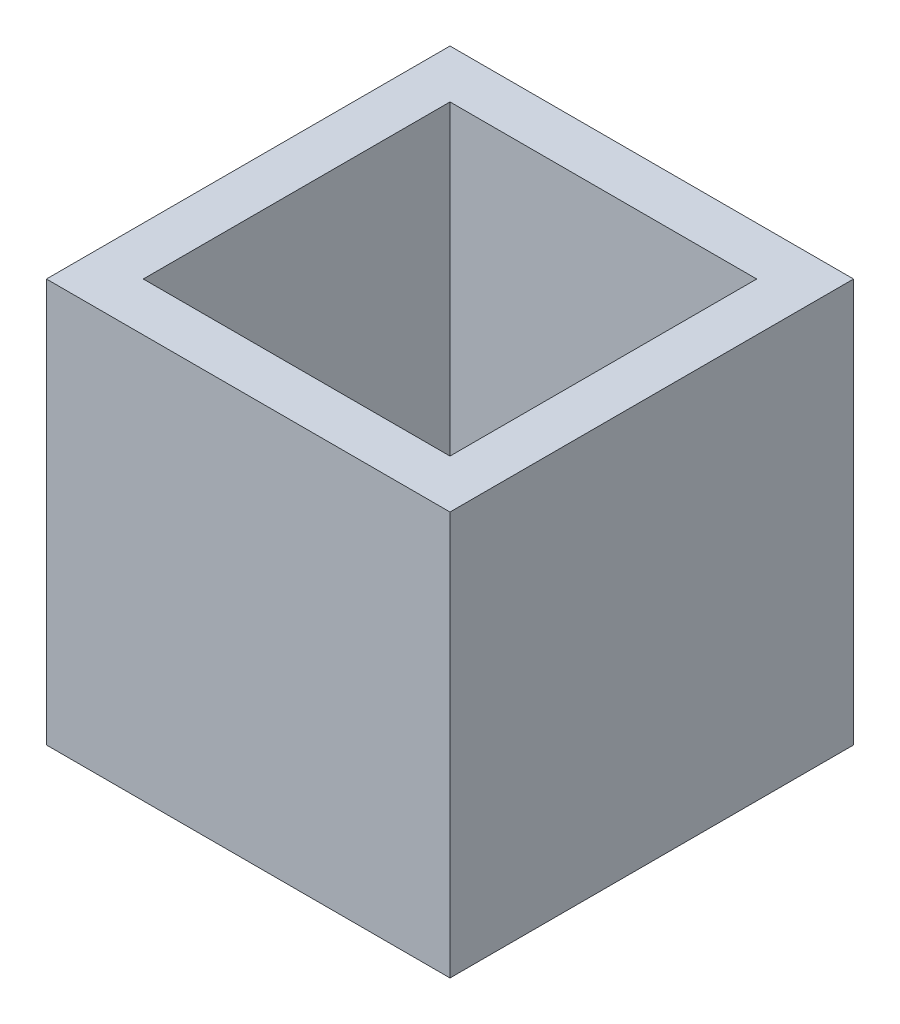
from build123d import *

# Parameters (mm, degrees)
SKETCH1_W           = 25
SKETCH1_H           = 25
BOSS_EXTRUDE1_DEPTH = 25
SHELL1_T            = 3
SKETCH3_W           = 19
SKETCH3_H           = 19
CUT_EXTRUDE2_DEPTH  = 17


with BuildPart() as part:
    # Sketch1 → Boss-Extrude1 (new body)
    with BuildSketch(Plane(origin=(0, 0, 0), x_dir=(1, 0, 0), z_dir=(0, 1, 0))):
        Rectangle(SKETCH1_W, SKETCH1_H)
    extrude(amount=BOSS_EXTRUDE1_DEPTH)

    # Shell1 (no face opened: a closed hollow body)
    add(offset(amount=-SHELL1_T, mode=Mode.PRIVATE), mode=Mode.SUBTRACT)

    # Sketch3 → Cut-Extrude2 (cut)
    with BuildSketch(Plane(origin=(0, 25, 0), x_dir=(1, 0, 0), z_dir=(0, 1, 0))):
        Rectangle(SKETCH3_W, SKETCH3_H)
    extrude(amount=-CUT_EXTRUDE2_DEPTH, mode=Mode.SUBTRACT)


solid = part.part
